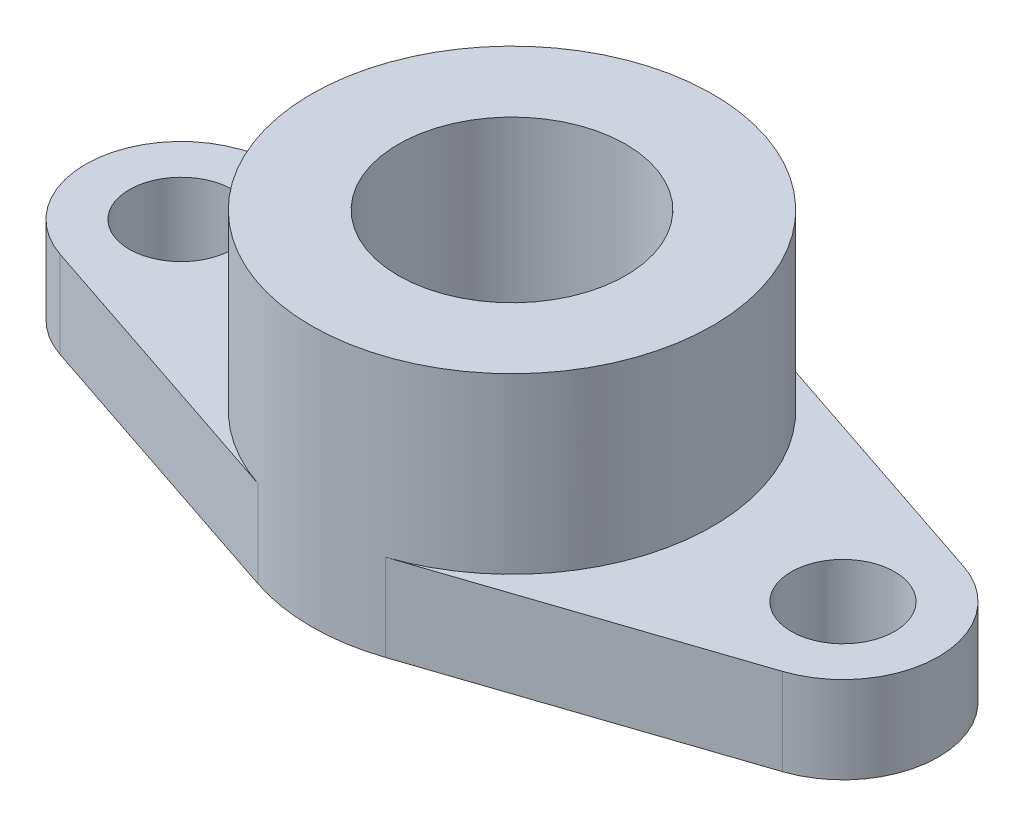
from build123d import *

# Parameters (mm, degrees)
SKETCH1_R           = 4.826
SKETCH1_R_2         = 2.9765625
BOSS_EXTRUDE1_DEPTH = 5
SKETCH2_R           = 11.548437406
SKETCH2_R_2         = 6.5484375
BOSS_EXTRUDE2_DEPTH = 10.000000066


with BuildPart() as part:
    # Sketch1 → Boss-Extrude1 (new body)
    with BuildSketch(Plane(origin=(0, 0, 0), x_dir=(1, 0, 0), z_dir=(0, 1, 0))):
        with BuildLine():
            Line((20.796268019, 5.215414513), (3.666666678, 10.950888639))
            ThreePointArc((3.666666678, 10.950888639), (0, 11.548437406), (-3.666666678, 10.950888639))
            Line((-3.666666678, 10.950888639), (-20.796268019, 5.215414513))
            ThreePointArc((-20.796268019, 5.215414513), (-24.550000049, 0), (-20.796268019, -5.215414513))
            Line((-20.796268019, -5.215414513), (-3.666666678, -10.950888639))
            ThreePointArc((-3.666666678, -10.950888639), (0, -11.548437406), (3.666666678, -10.950888639))
            Line((3.666666678, -10.950888639), (20.796268019, -5.215414513))
            ThreePointArc((20.796268019, -5.215414513), (24.550000049, 0), (20.796268019, 5.215414513))
        make_face()
        with Locations(Location((0, 0, 0), (0, 0, 270))):
            Circle(SKETCH1_R, mode=Mode.SUBTRACT)
        with Locations(Location((19.05, 0, 0), (0, 0, 270))):
            Circle(SKETCH1_R_2, mode=Mode.SUBTRACT)
        with Locations(Location((-19.05, 0, 0), (0, 0, 270))):
            Circle(SKETCH1_R_2, mode=Mode.SUBTRACT)
    extrude(amount=BOSS_EXTRUDE1_DEPTH)

    # Sketch2 → Boss-Extrude2 (add)
    with BuildSketch(Plane(origin=(0, 5, 0), x_dir=(1, 0, 0), z_dir=(0, 1, 0))):
        with Locations(Location((0, 0, 0), (0, 0, 71.48799955))):
            Circle(SKETCH2_R)
        with Locations(Location((0, 0, 0), (0, 0, 270))):
            Circle(SKETCH2_R_2, mode=Mode.SUBTRACT)
    extrude(amount=BOSS_EXTRUDE2_DEPTH)


solid = part.part
